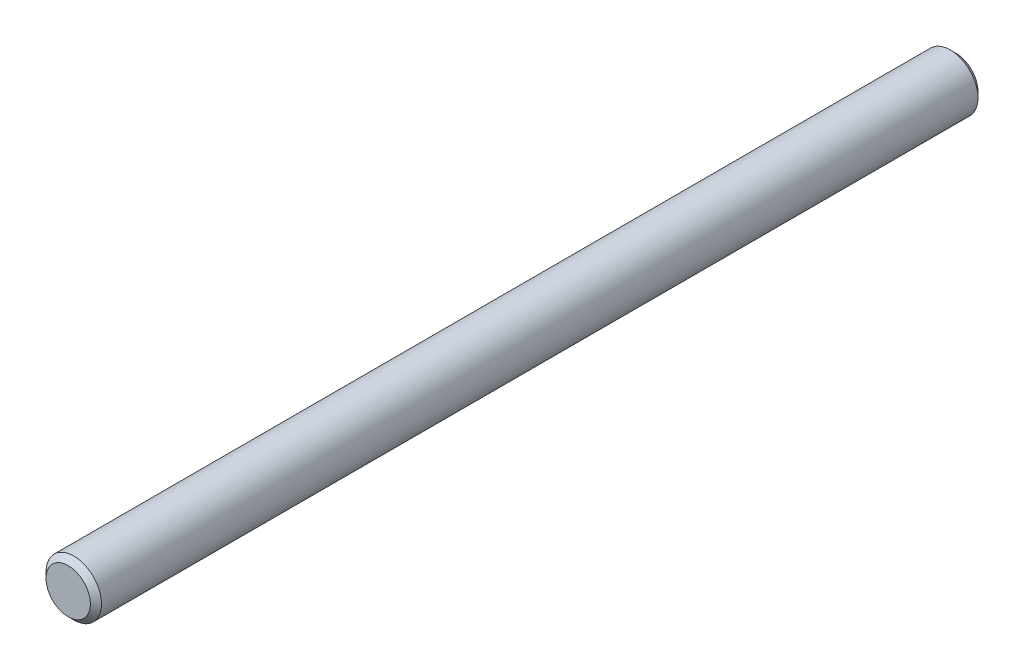
from build123d import *

# Parameters (mm, degrees)
SKETCH_1_R      = 2.5
EXTRUDE_1_DEPTH = 80
CHAMFER_1_SIZE  = 0.5


with BuildPart() as part:
    # 草图1 → 凸台-拉伸1 (new body)
    with BuildSketch(Plane.XY):
        Circle(SKETCH_1_R)
    extrude(amount=EXTRUDE_1_DEPTH)

    # 倒角1
    chamfer_1_edges = [part.edges().sort_by_distance(p)[0] for p in [
        (-2.5, 0, 0),
        (-2.5, 0, 80),
    ]]
    chamfer(chamfer_1_edges, length=CHAMFER_1_SIZE)


solid = part.part
